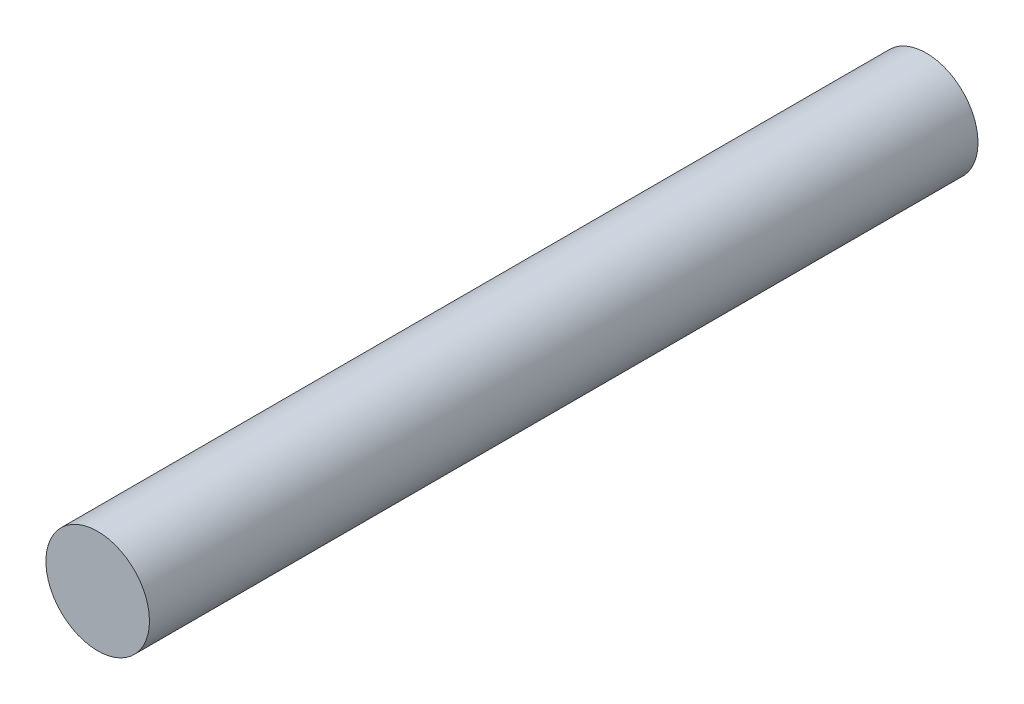
from build123d import *

# Parameters (mm, degrees)
SKETCH1_R      = 6.35
EXTRUDE1_DEPTH = 50.8


with BuildPart() as part:
    # Sketch1 → Extrude1 (new, symmetric)
    with BuildSketch(Plane.XY):
        Circle(SKETCH1_R)
    extrude(amount=EXTRUDE1_DEPTH, both=True)


solid = part.part
